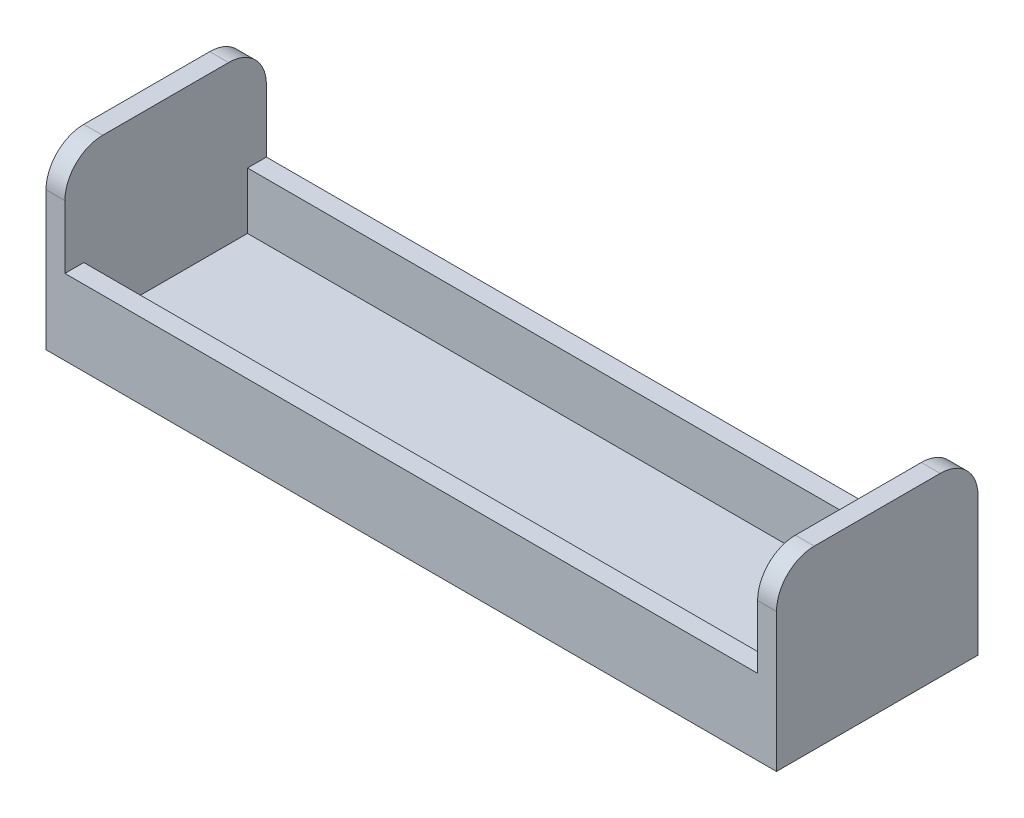
from build123d import *

# Parameters (mm, degrees)
BOSS_EXTRUDE1_DEPTH     = 29
CUT_EXTRUDE1_DEPTH      = 34.181320046
CUT_EXTRUDE1_DEPTH_BACK = 34.181320046
SKETCH4_W               = 55
SKETCH4_H               = 16
SKETCH5_W               = 55
SKETCH5_H               = 13
CUT_EXTRUDE2_DEPTH      = 4.5


with BuildPart() as part:
    # Sketch3 → Boss-Extrude1 (new, symmetric)
    with BuildSketch(Plane(origin=(0, 0, 0), x_dir=(0, 0, -1), z_dir=(1, 0, 0))):
        with BuildLine():
            Line((-8, 0), (8, 0))
            Line((8, 0), (8, 11))
            ThreePointArc((8, 11), (7.121320344, 13.121320344), (5, 14))
            Line((5, 14), (-5, 14))
            ThreePointArc((-5, 14), (-7.121320344, 13.121320344), (-8, 11))
            Line((-8, 11), (-8, 0))
        make_face()
    extrude(amount=BOSS_EXTRUDE1_DEPTH, both=True)

    # Sketch4 → Cut-Extrude1 (cut, two sides: drawn at the far end of the back side and taken through both)
    with BuildSketch(Plane.XY.offset(-CUT_EXTRUDE1_DEPTH_BACK)):
        with Locations((0, 14)):
            Rectangle(SKETCH4_W, SKETCH4_H)
    extrude(amount=CUT_EXTRUDE1_DEPTH + CUT_EXTRUDE1_DEPTH_BACK, mode=Mode.SUBTRACT)

    # Sketch5 → Cut-Extrude2 (cut)
    with BuildSketch(Plane(origin=(0, 6, 0), x_dir=(1, 0, 0), z_dir=(0, 1, 0))):
        Rectangle(SKETCH5_W, SKETCH5_H)
    extrude(amount=-CUT_EXTRUDE2_DEPTH, mode=Mode.SUBTRACT)


solid = part.part
